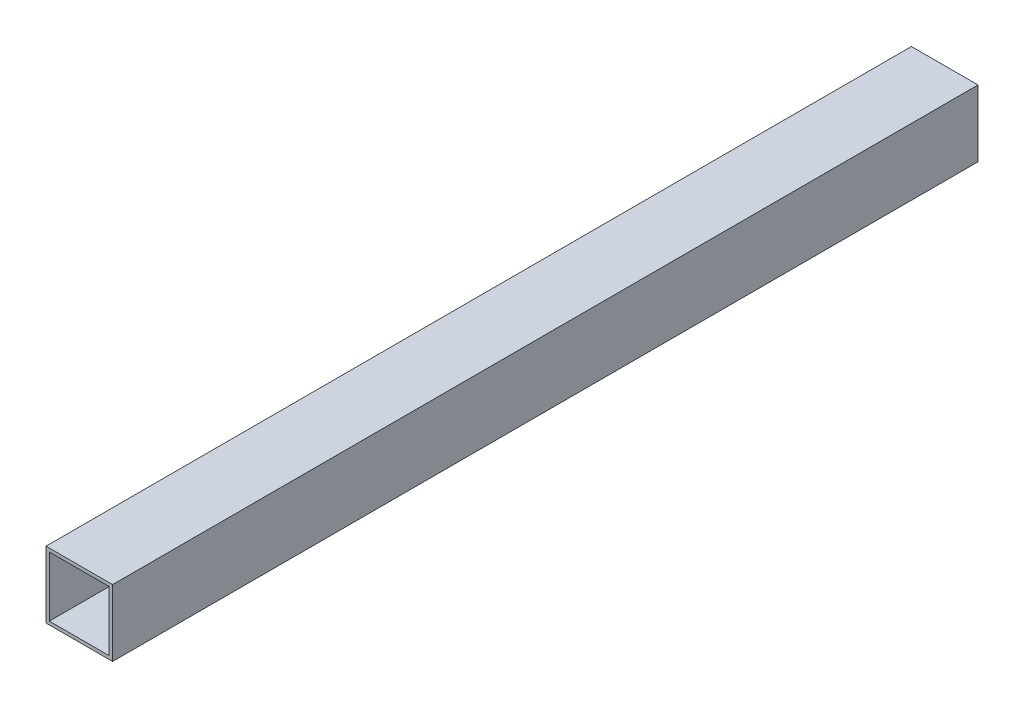
from build123d import *

# Parameters (mm, degrees)
SKETCH_1_W      = 20
SKETCH_1_H      = 20
SKETCH_1_W_2    = 18
SKETCH_1_H_2    = 18
EXTRUDE_1_DEPTH = 260


with BuildPart() as part:
    # 草图1 → 凸台-拉伸1 (new body)
    with BuildSketch(Plane.XY):
        Rectangle(SKETCH_1_W, SKETCH_1_H)
        Rectangle(SKETCH_1_W_2, SKETCH_1_H_2, mode=Mode.SUBTRACT)
    extrude(amount=EXTRUDE_1_DEPTH)


solid = part.part
